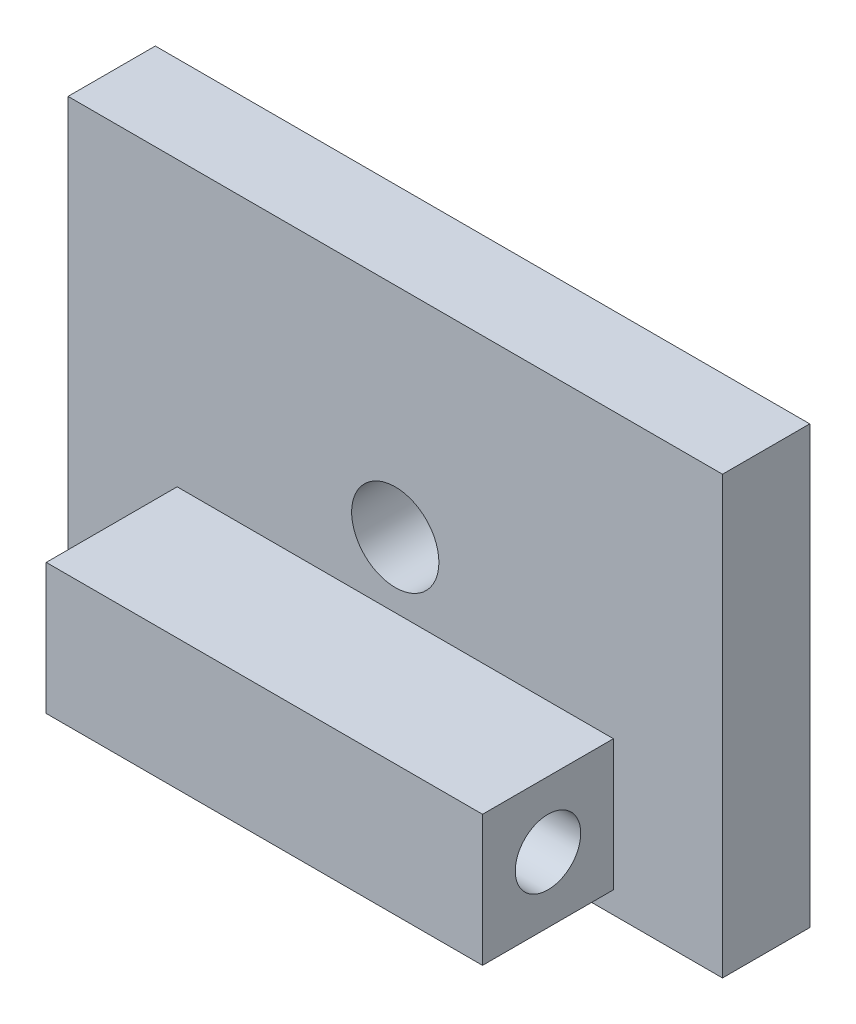
from build123d import *

# Parameters (mm, degrees)
SKETCH1_W           = 30
SKETCH1_H           = 20
SKETCH1_R           = 2
BOSS_EXTRUDE1_DEPTH = 4
SKETCH2_W           = 20
SKETCH2_H           = 6
BOSS_EXTRUDE2_DEPTH = 6
SKETCH4_R           = 1.5
CUT_EXTRUDE1_DEPTH  = 18
SKETCH5_R           = 1.2
CUT_EXTRUDE2_DEPTH  = 6


with BuildPart() as part:
    # Sketch1 → Boss-Extrude1 (new body)
    with BuildSketch(Plane.XY):
        Rectangle(SKETCH1_W, SKETCH1_H)
        Circle(SKETCH1_R, mode=Mode.SUBTRACT)
    extrude(amount=BOSS_EXTRUDE1_DEPTH)

    # Sketch2 → Boss-Extrude2 (add)
    with BuildSketch(Plane.XY.offset(4)):
        with Locations((0, -6)):
            Rectangle(SKETCH2_W, SKETCH2_H)
    extrude(amount=BOSS_EXTRUDE2_DEPTH)

    # Sketch4 → Cut-Extrude1 (cut)
    with BuildSketch(Plane(origin=(10, 0, 0), x_dir=(0, 0, -1), z_dir=(1, 0, 0))):
        with Locations((-7, -6)):
            Circle(SKETCH4_R)
    extrude(amount=-CUT_EXTRUDE1_DEPTH, mode=Mode.SUBTRACT)

    # Sketch5 → Cut-Extrude2 (cut)
    with BuildSketch(Plane(origin=(-8, 0, 0), x_dir=(0, 0, -1), z_dir=(1, 0, 0))):
        with Locations((-7, -6)):
            Circle(SKETCH5_R)
    extrude(amount=-CUT_EXTRUDE2_DEPTH, mode=Mode.SUBTRACT)


solid = part.part
